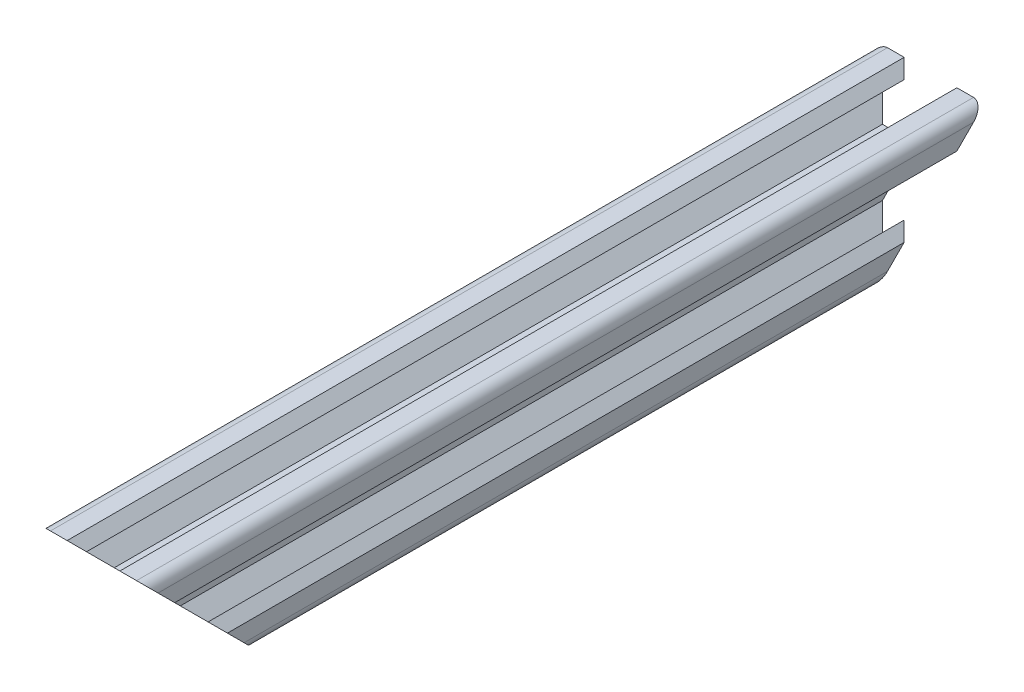
from build123d import *

# Parameters (mm, degrees)
SKETCH1_R           = 2.1
BOSS_EXTRUDE1_DEPTH = 155.6
CUT_EXTRUDE1_DEPTH  = 66


with BuildPart() as part:
    # Sketch1 → Boss-Extrude1 (new body)
    with BuildSketch(Plane.XY):
        with BuildLine():
            Line((-4.9, -10), (-3.1, -8.2))
            Line((-3.1, -8.2), (-5.5, -8.2))
            Line((-5.5, -8.2), (-5.5, -6.560660172))
            Line((-5.5, -6.560660172), (-2.539339828, -3.6))
            Line((-2.539339828, -3.6), (2.539339828, -3.6))
            Line((2.539339828, -3.6), (5.5, -6.560660172))
            Line((5.5, -6.560660172), (5.5, -8.2))
            Line((5.5, -8.2), (3.1, -8.2))
            Line((3.1, -8.2), (4.9, -10))
            Line((4.9, -10), (8, -10))
            ThreePointArc((8, -10), (9.414213562, -9.414213562), (10, -8))
            Line((10, -8), (10, -4.9))
            Line((10, -4.9), (8.2, -3.1))
            Line((8.2, -3.1), (8.2, -5.5))
            Line((8.2, -5.5), (6.560660172, -5.5))
            Line((6.560660172, -5.5), (3.6, -2.539339828))
            Line((3.6, -2.539339828), (3.6, 2.539339828))
            Line((3.6, 2.539339828), (6.560660172, 5.5))
            Line((6.560660172, 5.5), (8.2, 5.5))
            Line((8.2, 5.5), (8.2, 3.1))
            Line((8.2, 3.1), (10, 4.9))
            Line((10, 4.9), (10, 8))
            ThreePointArc((10, 8), (9.414213562, 9.414213562), (8, 10))
            Line((8, 10), (4.9, 10))
            Line((4.9, 10), (3.1, 8.2))
            Line((3.1, 8.2), (5.5, 8.2))
            Line((5.5, 8.2), (5.5, 6.560660172))
            Line((5.5, 6.560660172), (2.539339828, 3.6))
            Line((2.539339828, 3.6), (-2.539339828, 3.6))
            Line((-2.539339828, 3.6), (-5.5, 6.560660172))
            Line((-5.5, 6.560660172), (-5.5, 8.2))
            Line((-5.5, 8.2), (-3.1, 8.2))
            Line((-3.1, 8.2), (-4.9, 10))
            Line((-4.9, 10), (-8, 10))
            ThreePointArc((-8, 10), (-9.414213562, 9.414213562), (-10, 8))
            Line((-10, 8), (-10, 4.9))
            Line((-10, 4.9), (-8.2, 3.1))
            Line((-8.2, 3.1), (-8.2, 5.5))
            Line((-8.2, 5.5), (-6.560660172, 5.5))
            Line((-6.560660172, 5.5), (-3.6, 2.539339828))
            Line((-3.6, 2.539339828), (-3.6, -2.539339828))
            Line((-3.6, -2.539339828), (-6.560660172, -5.5))
            Line((-6.560660172, -5.5), (-8.2, -5.5))
            Line((-8.2, -5.5), (-8.2, -3.1))
            Line((-8.2, -3.1), (-10, -4.9))
            Line((-10, -4.9), (-10, -8))
            ThreePointArc((-10, -8), (-9.414213562, -9.414213562), (-8, -10))
            Line((-8, -10), (-4.9, -10))
        make_face()
        Circle(SKETCH1_R, mode=Mode.SUBTRACT)
    extrude(amount=BOSS_EXTRUDE1_DEPTH)

    # Sketch2 → Cut-Extrude1 (cut)
    with BuildSketch(Plane.ZY.offset(10)):
        Polygon((155.6, 10), (135.6, -10), (155.6, -10), align=None)
        Polygon((0, 10), (20, -10), (0, -10), align=None)
    extrude(amount=-CUT_EXTRUDE1_DEPTH, mode=Mode.SUBTRACT)


solid = part.part
